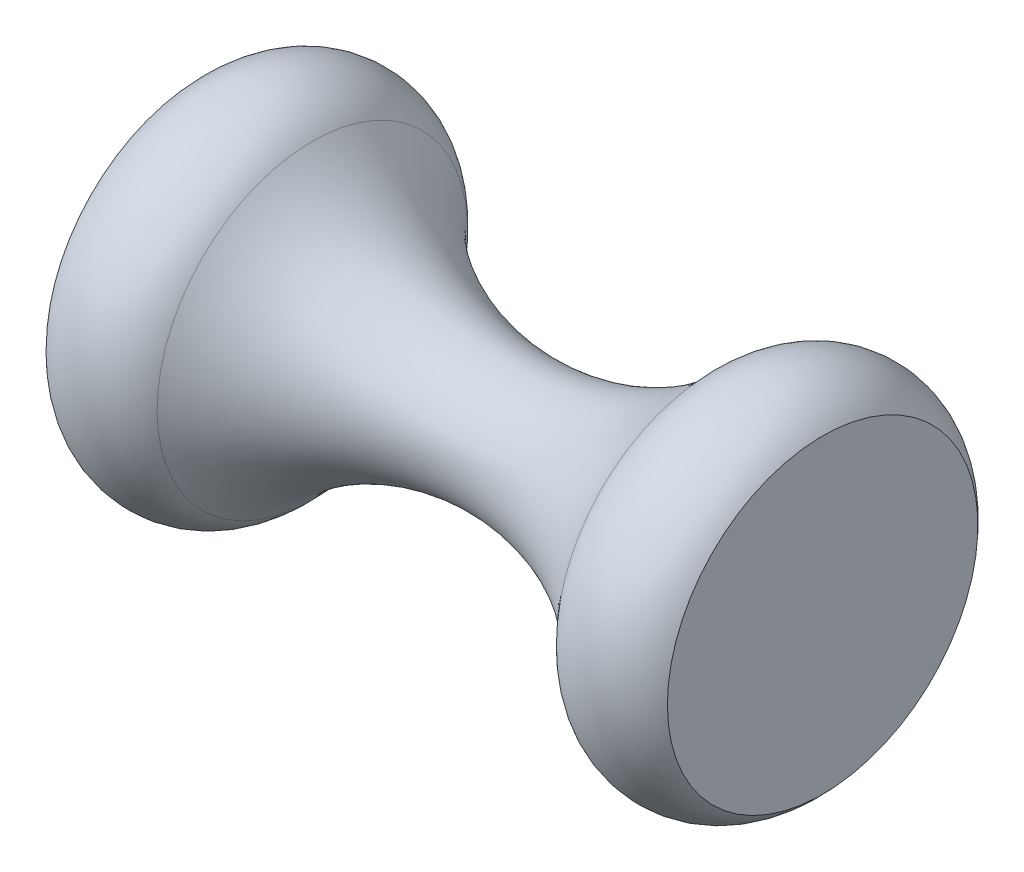
from build123d import *


with BuildPart() as part:
    # Sketch1 → Revolve1 (revolve)
    with BuildSketch(Plane.XY, mode=Mode.PRIVATE) as revolve1_sk:
        with BuildLine():
            Line((-25, 0), (25, 0))
            Line((25, 0), (25, -12.5))
            ThreePointArc((25, -12.5), (20.542853971, -14.578155052), (16.085707942, -12.5))
            ThreePointArc((16.085707942, -12.5), (0, -5), (-16.085707942, -12.5))
            ThreePointArc((-16.085707942, -12.5), (-20.542853971, -14.578155052), (-25, -12.5))
            Line((-25, -12.5), (-25, 0))
        make_face()
    revolve(revolve1_sk.sketch.rotate(Axis((-25, 0, 0), (1, 0, 0)), 270), axis=Axis((-25, 0, 0), (1, 0, 0)))


solid = part.part
